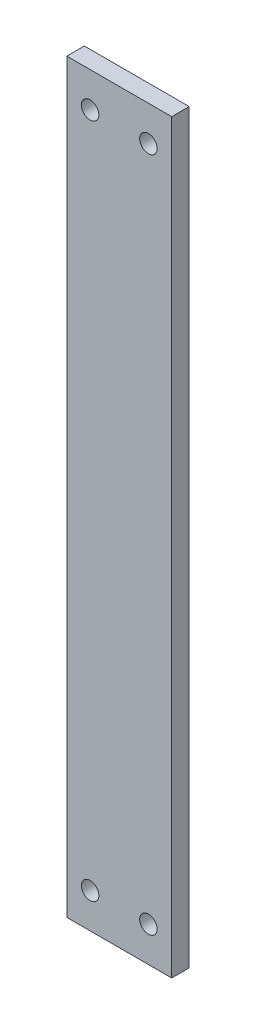
from build123d import *

# Parameters (mm, degrees)
SKETCH1_W           = 18
SKETCH1_H           = 128
SKETCH1_R           = 1.5
BOSS_EXTRUDE1_DEPTH = 3


with BuildPart() as part:
    # Sketch1 → Boss-Extrude1 (new body)
    with BuildSketch(Plane.XY):
        with Locations((9, 64)):
            Rectangle(SKETCH1_W, SKETCH1_H)
        with Locations((4, 6)):
            Circle(SKETCH1_R, mode=Mode.SUBTRACT)
        with Locations((14, 6)):
            Circle(SKETCH1_R, mode=Mode.SUBTRACT)
        with Locations((4, 122)):
            Circle(SKETCH1_R, mode=Mode.SUBTRACT)
        with Locations((14, 122)):
            Circle(SKETCH1_R, mode=Mode.SUBTRACT)
    extrude(amount=BOSS_EXTRUDE1_DEPTH)


solid = part.part
